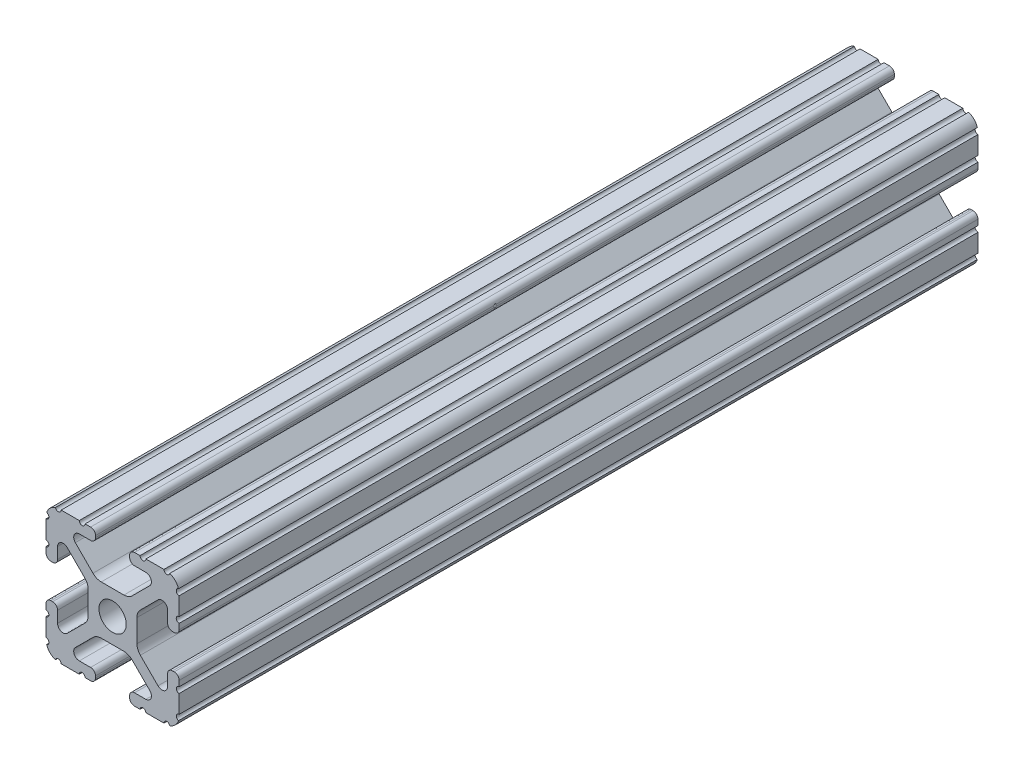
from build123d import *

# Parameters (mm, degrees)
BOSS_EXTRUDE1_DEPTH     = 76.2
CUT_EXTRUDE1_DEPTH      = 79.288057838
CUT_EXTRUDE1_DEPTH_BACK = 79.288057838
SKETCH5_R               = 0.55245
SKETCH6_R               = 3.2639
CUT_EXTRUDE2_DEPTH      = 82.319677815


with BuildPart() as part:
    # Sketch4 → Boss-Extrude1 (new, symmetric)
    with BuildSketch(Plane.XY):
        with BuildLine():
            Line((4.190365, -12.7), (10.11729625, -12.7))
            ThreePointArc((10.11729625, -12.7), (11.943543585, -11.943543585), (12.7, -10.11729625))
            Line((12.7, -10.11729625), (12.7, -4.190365))
            ThreePointArc((12.7, -4.190365), (12.42492494, -3.52627506), (11.760835, -3.2512))
            Line((11.760835, -3.2512), (11.429365, -3.2512))
            ThreePointArc((11.429365, -3.2512), (10.76527506, -3.52627506), (10.4902, -4.190365))
            Line((10.4902, -4.190365), (10.4902, -6.348478019))
            ThreePointArc((10.4902, -6.348478019), (9.830707141, -7.335478831), (8.666460301, -7.103895736))
            Line((8.666460301, -7.103895736), (5.299899128, -3.737334563))
            ThreePointArc((5.299899128, -3.737334563), (4.817571085, -3.015479634), (4.6482, -2.16399369))
            Line((4.6482, -2.16399369), (4.6482, 0))
            Line((4.6482, 0), (2.6035, 0))
            ThreePointArc((2.6035, 0), (1.840952505, -1.840952505), (0, -2.6035))
            Line((0, -2.6035), (0, -4.6482))
            Line((0, -4.6482), (2.16399369, -4.6482))
            ThreePointArc((2.16399369, -4.6482), (3.015479634, -4.817571085), (3.737334563, -5.299899128))
            Line((3.737334563, -5.299899128), (7.103895736, -8.666460301))
            ThreePointArc((7.103895736, -8.666460301), (7.335478831, -9.830707141), (6.348478019, -10.4902))
            Line((6.348478019, -10.4902), (4.190365, -10.4902))
            ThreePointArc((4.190365, -10.4902), (3.52627506, -10.76527506), (3.2512, -11.429365))
            Line((3.2512, -11.429365), (3.2512, -11.760835))
            ThreePointArc((3.2512, -11.760835), (3.52627506, -12.42492494), (4.190365, -12.7))
        make_face()
    extrude(amount=BOSS_EXTRUDE1_DEPTH, both=True)

    # Sketch5 → Cut-Extrude1 (cut, two sides: drawn at the far end of the back side and taken through both)
    with BuildSketch(Plane.XY.offset(-CUT_EXTRUDE1_DEPTH_BACK)):
        with Locations((10.356153152, -12.7)):
            Circle(SKETCH5_R)
        with Locations((5.796028019, -12.7)):
            Circle(SKETCH5_R)
        with Locations((12.7, -10.356153152)):
            Circle(SKETCH5_R)
        with Locations((12.7, -5.796028019)):
            Circle(SKETCH5_R)
    extrude(amount=CUT_EXTRUDE1_DEPTH + CUT_EXTRUDE1_DEPTH_BACK, mode=Mode.SUBTRACT)

    # Mirror1: part across plane


with BuildPart() as part_1:
    add(part.part)
    add(part.part.mirror(Plane(origin=(0, 0, 0), x_dir=(0, 0, 1), z_dir=(1, 0, 0))))

    # Mirror2: part across plane


with BuildPart() as part_2:
    add(part_1.part)
    add(part_1.part.mirror(Plane.ZX))

    # Sketch6 → Cut-Extrude2 (cut, through all)
    with BuildSketch(Plane(origin=(0, 12.7, 0), x_dir=(1, 0, 0), z_dir=(0, 1, 0))):
        with Locations(Location((0, 0, 0), (0, 0, 311.529729521))):
            Circle(SKETCH6_R)
    extrude(amount=-CUT_EXTRUDE2_DEPTH, mode=Mode.SUBTRACT)


solid = part_2.part
